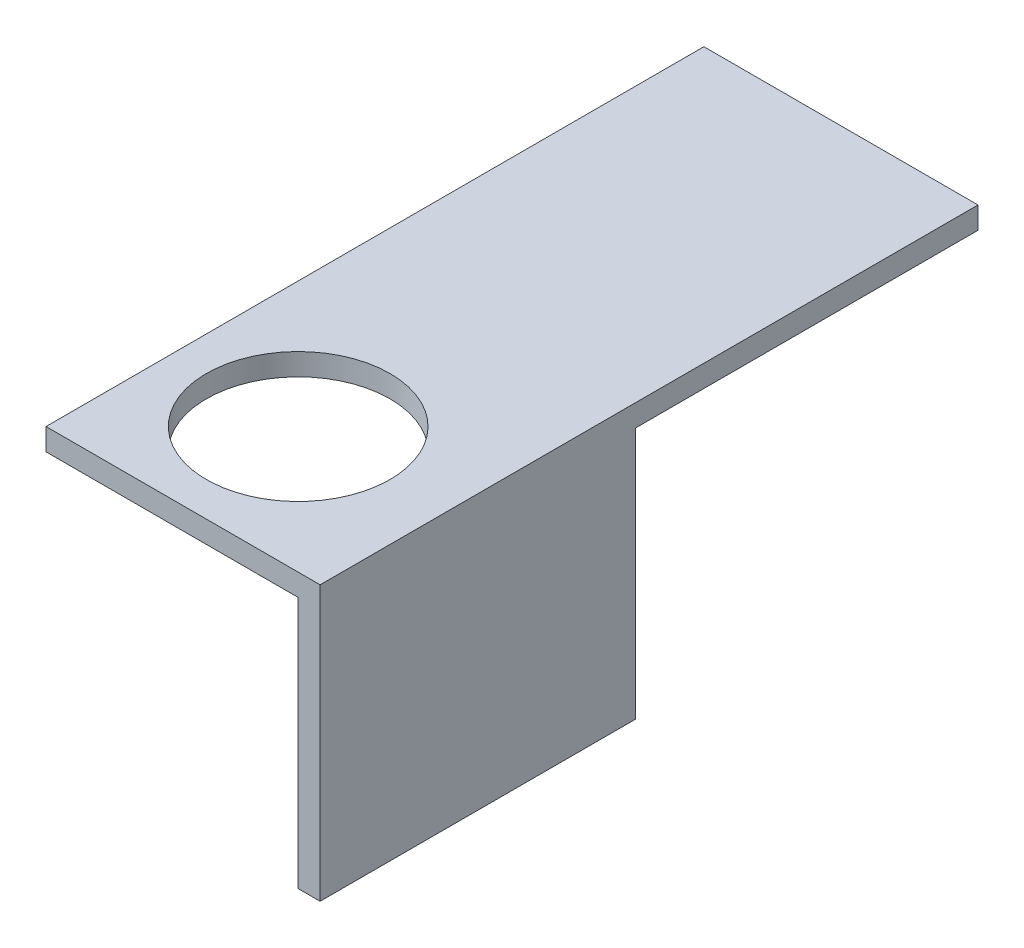
from build123d import *

# Parameters (mm, degrees)
SALIENTE_EXTRUIR1_DEPTH     = 120
CORTAR_EXTRUIR4_DEPTH       = 118
CORTAR_EXTRUIR4_DEPTH_BACK  = 26
CROQUIS2_W                  = 62.5
CROQUIS2_H                  = 46
CORTAR_EXTRUIR10_DEPTH      = 30
CORTAR_EXTRUIR10_DEPTH_BACK = 41
CROQUIS3_R                  = 16.752869439


with BuildPart() as part:
    # Croquis1 → Saliente-Extruir1 (new body)
    with BuildSketch(Plane.XY):
        Polygon((-124.610735746, 44.963996627), (-74.610735746, 44.963996627), (-74.610735746, -5.036003373), (-78.610735746, -5.036003373), (-78.610735746, 40.963996627), (-124.610735746, 40.963996627), align=None)
    extrude(amount=SALIENTE_EXTRUIR1_DEPTH)

    # Croquis2 → Cortar-Extruir4 (cut, two sides: drawn at the far end of the back side and taken through both)
    with BuildSketch(Plane.ZY.offset(78.610735746).offset(-CORTAR_EXTRUIR4_DEPTH_BACK)):
        with Locations((31.25, 17.963996627)):
            Rectangle(CROQUIS2_W, CROQUIS2_H)
    extrude(amount=CORTAR_EXTRUIR4_DEPTH + CORTAR_EXTRUIR4_DEPTH_BACK, mode=Mode.SUBTRACT)

    # Croquis3 → Cortar-Extruir10 (cut, two sides: drawn at the far end of the back side and taken through both)
    with BuildSketch(Plane.XZ.offset(-40.963996627).offset(-CORTAR_EXTRUIR10_DEPTH_BACK)):
        with Locations(Location((-101.610735746, 97, 0), (0, 0, 270))):
            Circle(CROQUIS3_R)
    extrude(amount=CORTAR_EXTRUIR10_DEPTH + CORTAR_EXTRUIR10_DEPTH_BACK, mode=Mode.SUBTRACT)


solid = part.part
